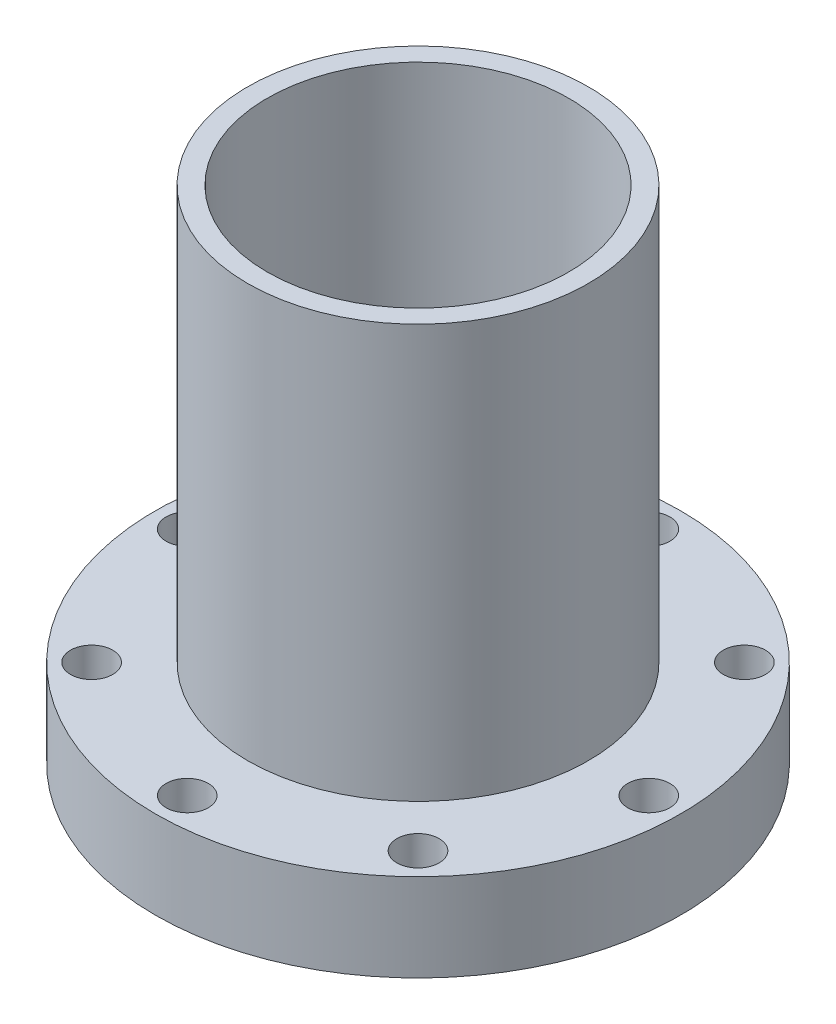
from build123d import *

# Parameters (mm, degrees)
SKETCH1_R               = 34.036
EXTRUDE1_DEPTH          = 82.55
SKETCH2_R               = 52.451
EXTRUDE2_DEPTH          = 17.526
CUT_EXTRUDE1_DEPTH      = 111.980706891
CUT_EXTRUDE1_DEPTH_BACK = 111.980706891
SKETCH3_R               = 30.099
SKETCH4_R               = 4.2164
CUT_EXTRUDE2_DEPTH      = 17.526
CIRPATTERN1_COUNT       = 8
CIRPATTERN3_COUNT       = 8


with BuildPart() as part:
    # Sketch1 → Extrude1 (new body)
    with BuildSketch(Plane(origin=(0, 0, 0), x_dir=(1, 0, 0), z_dir=(0, 1, 0))):
        Circle(SKETCH1_R)
    extrude(amount=EXTRUDE1_DEPTH)

    # Sketch2 → Extrude2 (add)
    with BuildSketch(Plane(origin=(0, 0, 0), x_dir=(1, 0, 0), z_dir=(0, 1, 0))):
        Circle(SKETCH2_R)
    extrude(amount=-EXTRUDE2_DEPTH)

    # Sketch3 → Cut-Extrude1 (cut, two sides: drawn at the far end of the back side and taken through both)
    with BuildSketch(Plane(origin=(0, 0, 0), x_dir=(1, 0, 0), z_dir=(0, 1, 0)).offset(-CUT_EXTRUDE1_DEPTH_BACK)):
        Circle(SKETCH3_R)
    extrude(amount=CUT_EXTRUDE1_DEPTH + CUT_EXTRUDE1_DEPTH_BACK, mode=Mode.SUBTRACT)

    # Sketch4 → Cut-Extrude2 (cut)
    with BuildSketch(Plane(origin=(0, 0, 0), x_dir=(1, 0, 0), z_dir=(0, 1, 0))):
        with Locations((0, 46.101)):
            Circle(SKETCH4_R)
    cut_extrude2 = extrude(amount=-CUT_EXTRUDE2_DEPTH, mode=Mode.SUBTRACT)

    # CirPattern1: Cut-Extrude2 ×8 about axis
    cirpattern1_axis = Axis((0, 58.676993495, 0), (0, -1, 0))
    for i in range(1, CIRPATTERN1_COUNT):
        add(cut_extrude2.rotate(cirpattern1_axis, i * 360 / CIRPATTERN1_COUNT), mode=Mode.SUBTRACT)

    # Sketch10 → 1/4-20 Tapped Hole2 (revolve, cut)
    with BuildSketch(Plane(origin=(13.365218875, -17.526, 32.266492673), x_dir=(0, 0, -1), z_dir=(1, 0, 0))):
        Polygon((0, 0), (0, 15.503816902), (2.5527, 13.97), (2.5527, 0), align=None)
    f_1_4_20_tapped_hole2 = revolve(axis=Axis((13.365218875, -23.876, 32.266492673), (0, 1, 0)), mode=Mode.SUBTRACT)

    # CirPattern3: 1/4-20 Tapped Hole2 ×8 about axis
    cirpattern3_axis = Axis((0, 58.676993495, 0), (0, -1, 0))
    for i in range(1, CIRPATTERN3_COUNT):
        add(f_1_4_20_tapped_hole2.rotate(cirpattern3_axis, i * 360 / CIRPATTERN3_COUNT), mode=Mode.SUBTRACT)


solid = part.part
